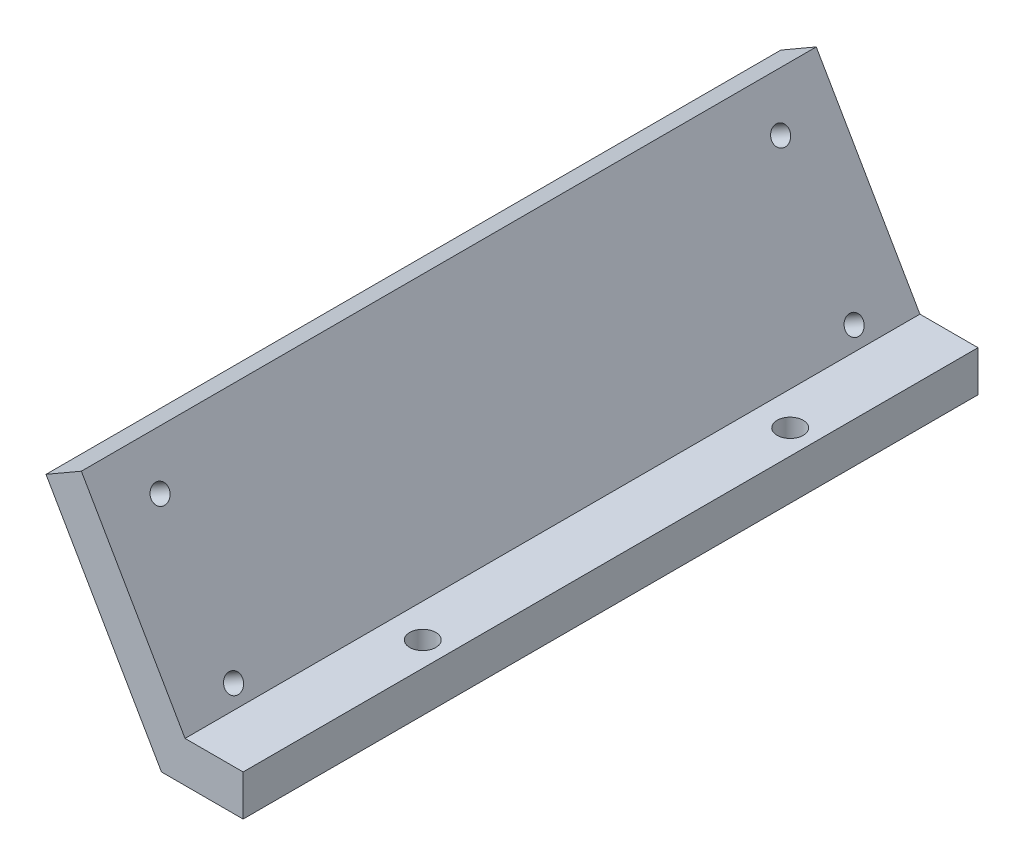
from build123d import *

# Parameters (mm, degrees)
EXTRUDE_1_DEPTH     = 90
SKETCH_2_R          = 1.6
CUT_EXTRUDE_1_DEPTH = 10
SKETCH_3_R          = 1.1
CUT_EXTRUDE_2_DEPTH = 10


with BuildPart() as part:
    # 草图1 → 凸台-拉伸1 (new body)
    with BuildSketch(Plane.XY):
        Polygon((0, 0), (-14.142135624, 24.494897428), (-9.812008605, 26.994897428), (2.886751346, 5), (10, 5), (10, 0), align=None)
    extrude(amount=EXTRUDE_1_DEPTH)

    # 草图2 → 切除-拉伸1 (cut)
    with BuildSketch(Plane(origin=(0, 5, 0), x_dir=(1, 0, 0), z_dir=(0, 1, 0))):
        with Locations(Location((7, -20, 0), (0, 0, 270))):
            Circle(SKETCH_2_R)
        with Locations(Location((7, -65, 0), (0, 0, 270))):
            Circle(SKETCH_2_R)
    extrude(amount=-CUT_EXTRUDE_1_DEPTH, mode=Mode.SUBTRACT)

    # 草图3 → 切除-拉伸2 (cut)
    with BuildSketch(Plane(origin=(0, 0, 0), x_dir=(0, 0, 1), z_dir=(-0.8660254037844363, -0.5000000000000043, 0))):
        with Locations(Location((7, 23, 0), (0, 0, 270))):
            Circle(SKETCH_3_R)
        with Locations(Location((83, 23, 0), (0, 0, 270))):
            Circle(SKETCH_3_R)
        with Locations(Location((83, 5, 0), (0, 0, 270))):
            Circle(SKETCH_3_R)
        with Locations(Location((7, 5, 0), (0, 0, 270))):
            Circle(SKETCH_3_R)
    extrude(amount=-CUT_EXTRUDE_2_DEPTH, mode=Mode.SUBTRACT)


solid = part.part
